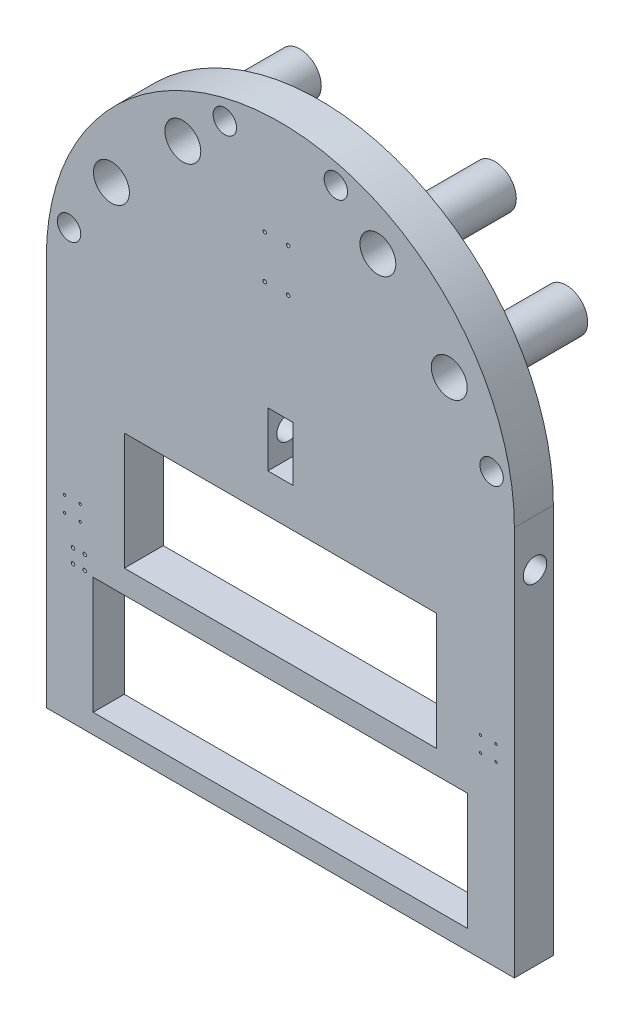
from build123d import *

# Parameters (mm, degrees)
SKETCH_1_R           = 23
EXTRUDE_1_DEPTH      = 50
EXTRUDE_START        = 100
SKETCH_2_R           = 27.5
SKETCH_2_R_2         = 23
EXTRUDE_2_DEPTH      = 100
SKETCH_3_R           = 15
CUT_EXTRUDE_1_DEPTH  = 788.400787401
SKETCH_4_W           = 32
SKETCH_4_H           = 70
CUT_EXTRUDE_2_DEPTH  = 100
SKETCH_5_W           = 400
SKETCH_5_H           = 150
CUT_EXTRUDE_3_DEPTH  = 603.07972894
SKETCH_6_W           = 480
SKETCH_6_H           = 150
CUT_EXTRUDE_4_DEPTH  = 100
SKETCH_7_W           = 500
SKETCH_7_H           = 170
CUT_EXTRUDE_5_DEPTH  = 10
SKETCH_9_R           = 2.25
CUT_EXTRUDE_6_DEPTH  = 5
SKETCH_10_R          = 15
CUT_EXTRUDE_7_DEPTH  = 30
SKETCH_11_R          = 2.25
CUT_EXTRUDE_8_DEPTH  = 30
SKETCH_12_R          = 1.5
CUT_EXTRUDE_9_DEPTH  = 10
SKETCH_13_R          = 1.5
CUT_EXTRUDE_10_DEPTH = 10


with BuildPart() as part:
    # 草图1 → 凸台-拉伸1 (new body)
    with BuildSketch(Plane.XY):
        with BuildLine():
            Line((-300, 0), (-300, -500))
            Line((-300, -500), (300, -500))
            Line((300, -500), (300, 0))
            ThreePointArc((300, 0), (0, 300), (-300, 0))
        make_face()
        with Locations((-216.506350946, 125)):
            Circle(SKETCH_1_R, mode=Mode.SUBTRACT)
        with Locations((-125, 216.506350946)):
            Circle(SKETCH_1_R, mode=Mode.SUBTRACT)
        with Locations(Location((125, 216.506350946, 0), (0, 0, 180))):
            Circle(SKETCH_1_R, mode=Mode.SUBTRACT)
        with Locations(Location((216.506350946, 125, 0), (0, 0, 180))):
            Circle(SKETCH_1_R, mode=Mode.SUBTRACT)
    extrude(amount=EXTRUDE_1_DEPTH)

    # 草图2 → 凸台-拉伸2 (add)
    # profile 1 of 4: a face of its own
    with BuildSketch(Plane(origin=(0, 0, 0), x_dir=(-1, 0, 0), z_dir=(0, 0, -1)).offset(EXTRUDE_START)):
        with Locations(Location((-216.506350946, 125, 0), (0, 0, 180))):
            Circle(SKETCH_2_R)
        with Locations((-216.506350946, 125)):
            Circle(SKETCH_2_R_2, mode=Mode.SUBTRACT)
    # profile 2 of 4: a face of its own
    with BuildSketch(Plane(origin=(0, 0, 0), x_dir=(-1, 0, 0), z_dir=(0, 0, -1)).offset(EXTRUDE_START)):
        with Locations(Location((-125, 216.506350946, 0), (0, 0, 180))):
            Circle(SKETCH_2_R)
        with Locations((-125, 216.506350946)):
            Circle(SKETCH_2_R_2, mode=Mode.SUBTRACT)
    # profile 3 of 4: a face of its own
    with BuildSketch(Plane(origin=(0, 0, 0), x_dir=(-1, 0, 0), z_dir=(0, 0, -1)).offset(EXTRUDE_START)):
        with Locations(Location((216.506350946, 125, 0), (0, 0, 180))):
            Circle(SKETCH_2_R)
        with Locations(Location((216.506350946, 125, 0), (0, 0, 180))):
            Circle(SKETCH_2_R_2, mode=Mode.SUBTRACT)
    # profile 4 of 4: a face of its own
    with BuildSketch(Plane(origin=(0, 0, 0), x_dir=(-1, 0, 0), z_dir=(0, 0, -1)).offset(EXTRUDE_START)):
        with Locations(Location((125, 216.506350946, 0), (0, 0, 180))):
            Circle(SKETCH_2_R)
        with Locations(Location((125, 216.506350946, 0), (0, 0, 180))):
            Circle(SKETCH_2_R_2, mode=Mode.SUBTRACT)
    extrude(amount=-EXTRUDE_2_DEPTH)

    # 草图3 → 切除-拉伸1 (cut, through all)
    with BuildSketch(Plane.ZY.offset(300)):
        with Locations((23.548349361, -60)):
            Circle(SKETCH_3_R)
    extrude(amount=-CUT_EXTRUDE_1_DEPTH, mode=Mode.SUBTRACT)

    # 草图4 → 切除-拉伸2 (cut)
    with BuildSketch(Plane.XY.offset(50)):
        with Locations((0, -60)):
            Rectangle(SKETCH_4_W, SKETCH_4_H)
    extrude(amount=-CUT_EXTRUDE_2_DEPTH, mode=Mode.SUBTRACT)

    # 草图5 → 切除-拉伸3 (cut, through all)
    with BuildSketch(Plane.XY.offset(50)):
        with Locations((0, -220)):
            Rectangle(SKETCH_5_W, SKETCH_5_H)
    extrude(amount=-CUT_EXTRUDE_3_DEPTH, mode=Mode.SUBTRACT)

    # 草图6 → 切除-拉伸4 (cut)
    with BuildSketch(Plane.XY.offset(50)):
        with Locations((0, -400)):
            Rectangle(SKETCH_6_W, SKETCH_6_H)
    extrude(amount=-CUT_EXTRUDE_4_DEPTH, mode=Mode.SUBTRACT)

    # 草图7 → 切除-拉伸5 (cut)
    with BuildSketch(Plane(origin=(0, 0, 0), x_dir=(-1, 0, 0), z_dir=(0, 0, -1))):
        with Locations((0, -400)):
            Rectangle(SKETCH_7_W, SKETCH_7_H)
    extrude(amount=-CUT_EXTRUDE_5_DEPTH, mode=Mode.SUBTRACT)

    # 草图9 → 切除-拉伸6 (cut)
    with BuildSketch(Plane.XY.offset(50)):
        with Locations((10, 113.043497002)):
            Circle(SKETCH_9_R)
        with Locations((-20, 113.043497002)):
            Circle(SKETCH_9_R)
        with Locations((-20, 168.205707409)):
            Circle(SKETCH_9_R)
        with Locations((10, 168.205707409)):
            Circle(SKETCH_9_R)
    extrude(amount=-CUT_EXTRUDE_6_DEPTH, mode=Mode.SUBTRACT)

    # 草图10 → 切除-拉伸7 (cut)
    with BuildSketch(Plane.XY.offset(50)):
        with Locations((-270.822132078, 47.753248858)):
            Circle(SKETCH_10_R)
        with Locations((-71.175237403, 265.629602229)):
            Circle(SKETCH_10_R)
        with Locations(Location((270.822132078, 47.753248858, 0), (0, 0, 180))):
            Circle(SKETCH_10_R)
        with Locations(Location((71.175237403, 265.629602229, 0), (0, 0, 180))):
            Circle(SKETCH_10_R)
    extrude(amount=-CUT_EXTRUDE_7_DEPTH, mode=Mode.SUBTRACT)

    # 草图11 → 切除-拉伸8 (cut)
    with BuildSketch(Plane.XY.offset(50)):
        with Locations((-265.77797753, -305.157271427)):
            Circle(SKETCH_11_R)
        with Locations((-250.77797753, -305.157271427)):
            Circle(SKETCH_11_R)
        with Locations((-265.77797753, -322.957271427)):
            Circle(SKETCH_11_R)
        with Locations((-250.77797753, -322.957271427)):
            Circle(SKETCH_11_R)
    extrude(amount=-CUT_EXTRUDE_8_DEPTH, mode=Mode.SUBTRACT)

    # 草图12 → 切除-拉伸9 (cut)
    with BuildSketch(Plane.XY.offset(50)):
        with Locations((-276.542958653, -251.964088139)):
            Circle(SKETCH_12_R)
        with Locations((-256.542958653, -251.964088139)):
            Circle(SKETCH_12_R)
        with Locations((-276.542958653, -271.964088139)):
            Circle(SKETCH_12_R)
        with Locations((-256.542958653, -271.964088139)):
            Circle(SKETCH_12_R)
    cut_extrude_9 = extrude(amount=-CUT_EXTRUDE_9_DEPTH, mode=Mode.SUBTRACT)

    # 镜向1: 切除-拉伸9 across plane
    add(cut_extrude_9.mirror(Plane(origin=(0, 0, 0), x_dir=(0, 0, 1), z_dir=(1, 0, 0))), mode=Mode.SUBTRACT)

    # 草图13 → 切除-拉伸10 (cut)
    with BuildSketch(Plane(origin=(0, 0, 0), x_dir=(-1, 0, 0), z_dir=(0, 0, -1))):
        with Locations((259.167415515, -123.923585862)):
            Circle(SKETCH_13_R)
        with Locations((234.167415515, -123.923585862)):
            Circle(SKETCH_13_R)
        with Locations((234.167415515, -148.923585862)):
            Circle(SKETCH_13_R)
        with Locations((259.167415515, -148.923585862)):
            Circle(SKETCH_13_R)
    extrude(amount=-CUT_EXTRUDE_10_DEPTH, mode=Mode.SUBTRACT)


solid = part.part
